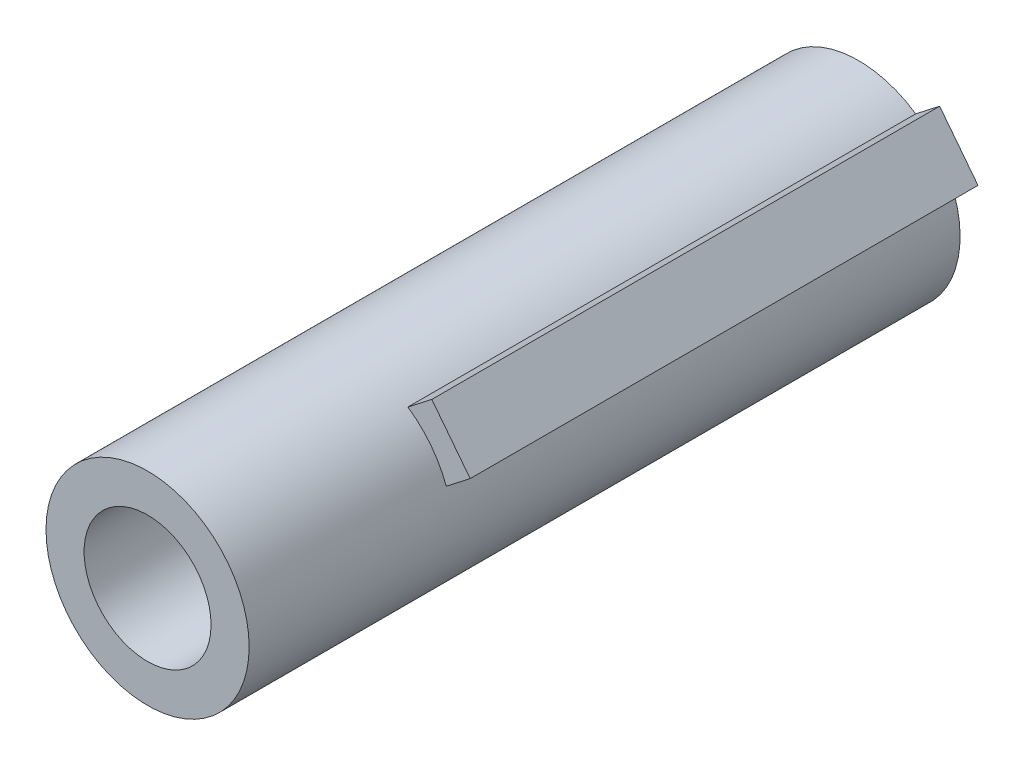
from build123d import *

# Parameters (mm, degrees)
EXTRUDE_1_DEPTH     = 20
SKETCH_2_R          = 4
EXTRUDE_2_DEPTH     = 8
SKETCH_3_R          = 2.5
CUT_EXTRUDE_1_DEPTH = 20


with BuildPart() as part:
    # 草图1 → 凸台-拉伸1 (new body)
    with BuildSketch(Plane.XY):
        with BuildLine():
            Line((3.195386911, 4.038125731), (2.251763738, 3.305988516))
            ThreePointArc((2.251763738, 3.305988516), (-3.160315011, -2.452021418), (3.761777443, 1.359790599))
            Line((3.761777443, 1.359790599), (4.705400616, 2.091927813))
            Line((4.705400616, 2.091927813), (3.195386911, 4.038125731))
        make_face()
    extrude(amount=EXTRUDE_1_DEPTH)

    # 草图2 → 凸台-拉伸2 (add)
    with BuildSketch(Plane.XY.offset(20)):
        with Locations(Location((0, 0, 0), (0, 0, 55.740572038))):
            Circle(SKETCH_2_R)
    extrude(amount=EXTRUDE_2_DEPTH)

    # 草图3 → 切除-拉伸1 (cut)
    with BuildSketch(Plane.XY.offset(28)):
        Circle(SKETCH_3_R)
    extrude(amount=-CUT_EXTRUDE_1_DEPTH, mode=Mode.SUBTRACT)


solid = part.part
